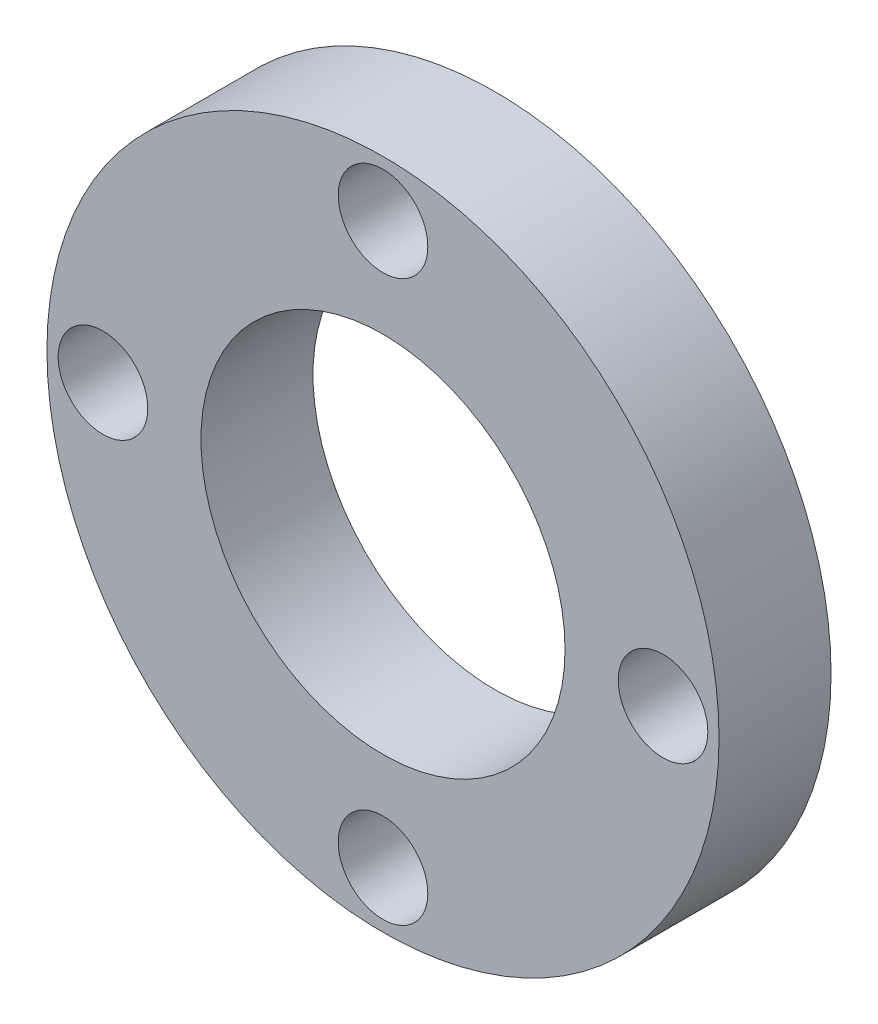
from build123d import *

# Parameters (mm, degrees)
SKETCH_1_R      = 12
SKETCH_1_R_2    = 6.5
SKETCH_1_R_3    = 1.6
EXTRUDE_1_DEPTH = 4


with BuildPart() as part:
    # 草图1 → 凸台-拉伸1 (new body)
    with BuildSketch(Plane.XY):
        Circle(SKETCH_1_R)
        Circle(SKETCH_1_R_2, mode=Mode.SUBTRACT)
        with Locations((0, 10)):
            Circle(SKETCH_1_R_3, mode=Mode.SUBTRACT)
        with Locations((10, 0)):
            Circle(SKETCH_1_R_3, mode=Mode.SUBTRACT)
        with Locations((0, -10)):
            Circle(SKETCH_1_R_3, mode=Mode.SUBTRACT)
        with Locations((-10, 0)):
            Circle(SKETCH_1_R_3, mode=Mode.SUBTRACT)
    extrude(amount=EXTRUDE_1_DEPTH)


solid = part.part
